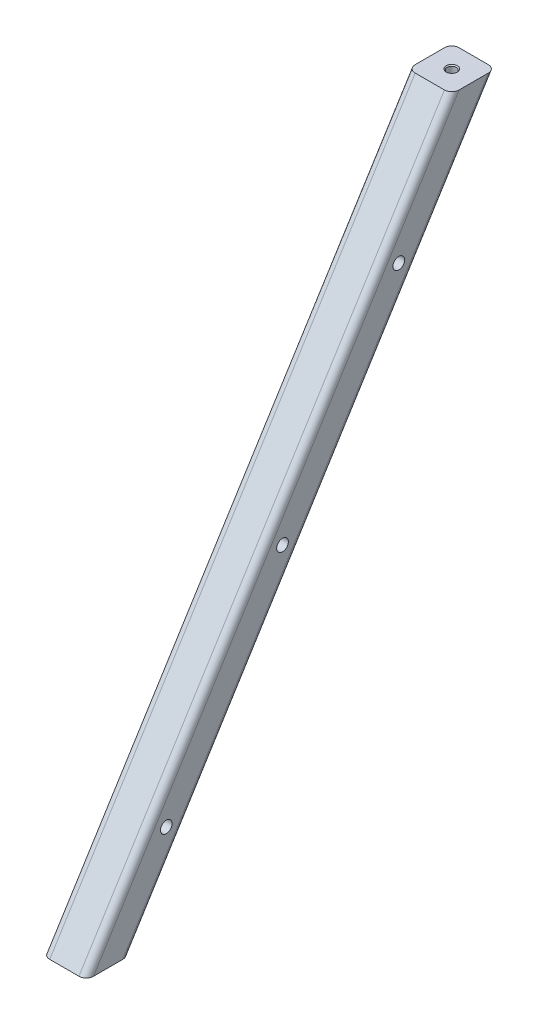
from build123d import *

# Parameters (mm, degrees)
HOLE_WIZARD_M3_1_D           = 2.5
HOLE_WIZARD_M3_1_DEPTH       = 5.248924226
HOLE_WIZARD_M3_1_CSINK_D     = 3.05
HOLE_WIZARD_M3_1_CSINK_ANGLE = 90
HOLE_WIZARD_M3_1_TIP         = 0.751075774
HOLE_WIZARD_M3_2_D           = 2.5
HOLE_WIZARD_M3_2_DEPTH       = 5.248924226
HOLE_WIZARD_M3_2_CSINK_D     = 3.05
HOLE_WIZARD_M3_2_CSINK_ANGLE = 90
HOLE_WIZARD_M3_2_TIP         = 0.751075774
CUT_EXTRUDE_1_REACH          = 194.302
SKETCH_7_R                   = 1.6


with BuildPart() as part:
    # 扫描2: sweep along a path in 草图2
    with BuildLine(Plane(origin=(0, 0, 0), x_dir=(0, 0, -1), z_dir=(1, 0, 0))) as sweep_2_path:
        Line((0, 0), (100, 160))
    # 草图1 → 扫描2 (sweep)
    with BuildSketch(Plane(origin=(0, 0, 0), x_dir=(1, 0, 0), z_dir=(0, 1, 0))):
        with BuildLine():
            Line((-4, 6), (4, 6))
            ThreePointArc((4, 6), (5.414213562, 5.414213562), (6, 4))
            Line((6, 4), (6, -4))
            ThreePointArc((6, -4), (5.414213562, -5.414213562), (4, -6))
            Line((4, -6), (-4, -6))
            ThreePointArc((-4, -6), (-5.414213562, -5.414213562), (-6, -4))
            Line((-6, -4), (-6, 4))
            ThreePointArc((-6, 4), (-5.414213562, 5.414213562), (-4, 6))
        make_face()
    sweep(path=sweep_2_path.line)

    # M3 螺纹孔1
    with Locations(Plane.XZ):
        with Locations((0, 0)):
            CounterSinkHole(HOLE_WIZARD_M3_1_D / 2, HOLE_WIZARD_M3_1_CSINK_D / 2, depth=HOLE_WIZARD_M3_1_DEPTH, counter_sink_angle=HOLE_WIZARD_M3_1_CSINK_ANGLE)
            with Locations((0, 0, -(HOLE_WIZARD_M3_1_DEPTH + HOLE_WIZARD_M3_1_TIP / 2))):  # 118° drill point
                Cone(0, HOLE_WIZARD_M3_1_D / 2, HOLE_WIZARD_M3_1_TIP, mode=Mode.SUBTRACT)

    # M3 螺纹孔2
    with Locations(Plane(origin=(0, 160, 0), x_dir=(1, 0, 0), z_dir=(0, 1, 0))):
        with Locations((0, 100)):
            CounterSinkHole(HOLE_WIZARD_M3_2_D / 2, HOLE_WIZARD_M3_2_CSINK_D / 2, depth=HOLE_WIZARD_M3_2_DEPTH, counter_sink_angle=HOLE_WIZARD_M3_2_CSINK_ANGLE)
            with Locations((0, 0, -(HOLE_WIZARD_M3_2_DEPTH + HOLE_WIZARD_M3_2_TIP / 2))):  # 118° drill point
                Cone(0, HOLE_WIZARD_M3_2_D / 2, HOLE_WIZARD_M3_2_TIP, mode=Mode.SUBTRACT)

    # 草图7 → 切除-拉伸1 (cut, up to next)
    with BuildSketch(Plane(origin=(6, 0, 0), x_dir=(0, 0, -1), z_dir=(1, 0, 0)), mode=Mode.PRIVATE) as cut_extrude_1_sk1:
        with Locations((15.8999682, 25.43994912)):
            Circle(SKETCH_7_R)
    cut_extrude_1_tool1 = extrude(cut_extrude_1_sk1.sketch, amount=-CUT_EXTRUDE_1_REACH, mode=Mode.PRIVATE) & part.part
    # 草图7 → 切除-拉伸1 (cut, up to next)
    with BuildSketch(Plane(origin=(6, 0, 0), x_dir=(0, 0, -1), z_dir=(1, 0, 0)), mode=Mode.PRIVATE) as cut_extrude_1_sk2:
        with Locations((47.6999046, 76.31984736)):
            Circle(SKETCH_7_R)
    cut_extrude_1_tool2 = extrude(cut_extrude_1_sk2.sketch, amount=-CUT_EXTRUDE_1_REACH, mode=Mode.PRIVATE) & part.part
    # 草图7 → 切除-拉伸1 (cut, up to next)
    with BuildSketch(Plane(origin=(6, 0, 0), x_dir=(0, 0, -1), z_dir=(1, 0, 0)), mode=Mode.PRIVATE) as cut_extrude_1_sk3:
        with Locations((79.499841, 127.199745601)):
            Circle(SKETCH_7_R)
    cut_extrude_1_tool3 = extrude(cut_extrude_1_sk3.sketch, amount=-CUT_EXTRUDE_1_REACH, mode=Mode.PRIVATE) & part.part
    add(cut_extrude_1_tool1.solids().sort_by_distance((6, 25.439949, -15.899968))[0], mode=Mode.SUBTRACT)
    add(cut_extrude_1_tool2.solids().sort_by_distance((6, 76.319847, -47.699905))[0], mode=Mode.SUBTRACT)
    add(cut_extrude_1_tool3.solids().sort_by_distance((6, 127.199746, -79.499841))[0], mode=Mode.SUBTRACT)


solid = part.part
